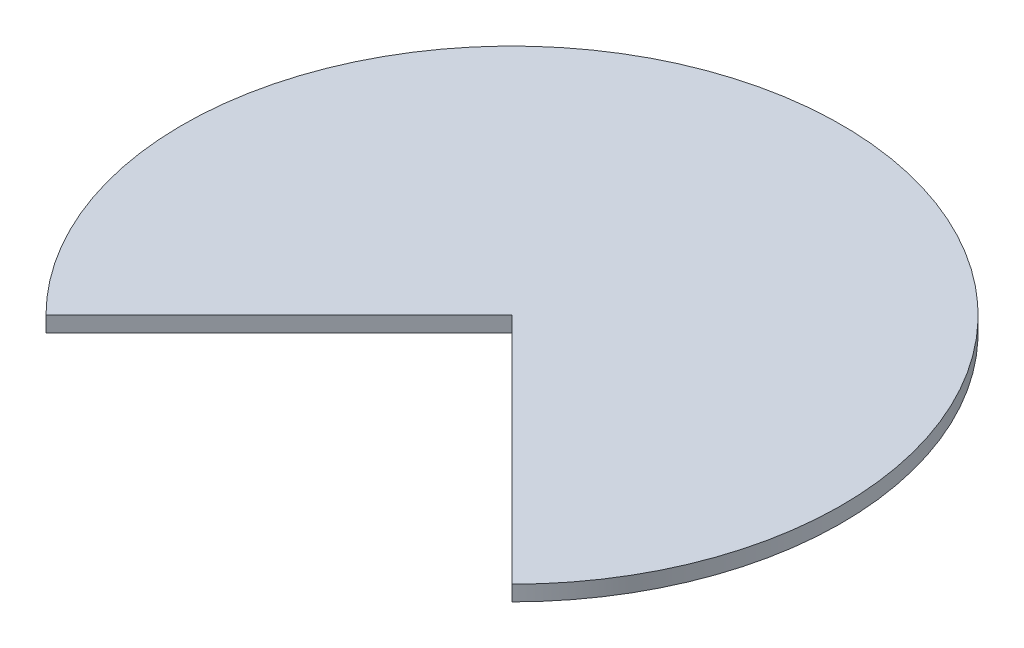
from build123d import *

# Parameters (mm, degrees)
BOSS_EXTRUDE1_DEPTH = 6.35


with BuildPart() as part:
    # Sketch1 → Boss-Extrude1 (new body)
    with BuildSketch(Plane(origin=(0, 0, 0), x_dir=(1, 0, 0), z_dir=(0, 1, 0))):
        with BuildLine():
            Line((0, 0), (-96.516779475, -96.516779475))
            ThreePointArc((-96.516779475, -96.516779475), (0, 136.49533853), (96.516779475, -96.516779475))
            Line((96.516779475, -96.516779475), (0, 0))
        make_face()
    extrude(amount=BOSS_EXTRUDE1_DEPTH)


solid = part.part
